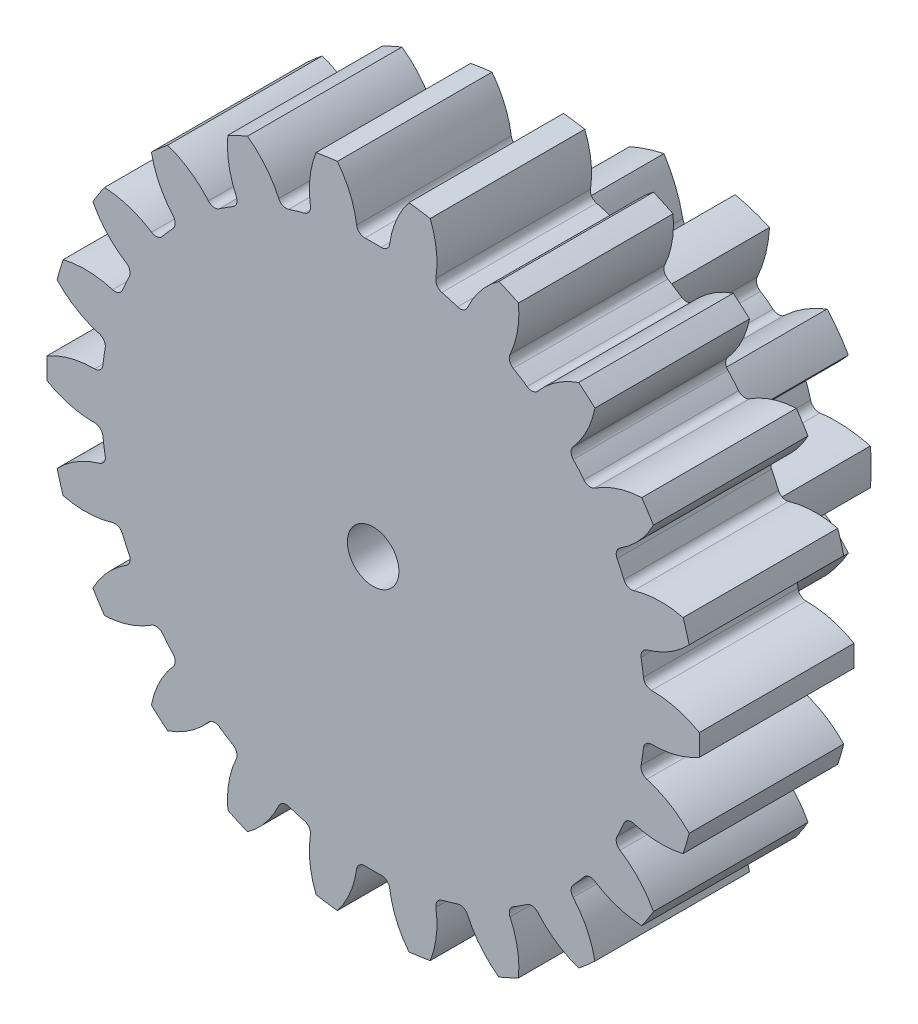
from build123d import *

# Parameters (mm, degrees)
SKETCH1_R                = 10
BOSS_EXTRUDE1_DEPTH      = 5
CUT_EXTRUDE1_DEPTH       = 16
FILLET2_R                = 0.5
CIRPATTERN1_COUNT        = 10
FILLET2_OF_CIRPATTERN1_R = 0.5
SKETCH4_R                = 19
BOSS_EXTRUDE2_DEPTH      = 9
CUT_EXTRUDE2_DEPTH       = 9
FILLET3_R                = 0.475
CIRPATTERN2_COUNT        = 22
FILLET3_OF_CIRPATTERN2_R = 0.475
SKETCH6_R                = 1.5
CUT_EXTRUDE3_DEPTH       = 33.843019557


with BuildPart() as part:
    # Sketch1 → Boss-Extrude1 (new, symmetric)
    with BuildSketch(Plane.XY):
        Circle(SKETCH1_R)
    extrude(amount=BOSS_EXTRUDE1_DEPTH, both=True)

    # Sketch3 → Cut-Extrude1 (cut, symmetric)
    with BuildSketch(Plane.XY):
        with BuildLine():
            ThreePointArc((-2.721939872, 10.657909895), (-1.519639498, 8.762901035), (-0.90177966, 6.605394605))
            ThreePointArc((-0.90177966, 6.605394605), (0, 6.666666667), (0.90177966, 6.605394605))
            ThreePointArc((0.90177966, 6.605394605), (1.519639498, 8.762901035), (2.721939872, 10.657909895))
            ThreePointArc((2.721939872, 10.657909895), (0, 11), (-2.721939872, 10.657909895))
        make_face()
    cut_extrude1 = extrude(amount=CUT_EXTRUDE1_DEPTH, both=True, mode=Mode.SUBTRACT)

    # Fillet2
    fillet2_edges = [part.edges().sort_by_distance(p)[0] for p in [
        (-0.90177966, 6.605394605, 0),
        (0.90177966, 6.605394605, 0),
    ]]
    fillet(fillet2_edges, radius=FILLET2_R)

    # CirPattern1: Cut-Extrude1 ×10 about axis
    cirpattern1_axis = Axis((0, 0, 0), (0, 0, 1))
    for i in range(1, CIRPATTERN1_COUNT):
        add(cut_extrude1.rotate(cirpattern1_axis, i * 360 / CIRPATTERN1_COUNT), mode=Mode.SUBTRACT)

    # Fillet2 of CirPattern1
    fillet2_of_cirpattern1_edges = [part.edges().sort_by_distance(p)[0] for p in [
        (-4.612108605, 4.813823705, 0),
        (-3.152998464, 5.873929275, 0),
        (-6.560768822, 1.183535765, 0),
        (-6.003438342, 2.89882261, 0),
        (-6.003438342, -2.89882261, 0),
        (-6.560768822, -1.183535765, 0),
        (-3.152998464, -5.873929275, 0),
        (-4.612108605, -4.813823705, 0),
        (0.90177966, -6.605394605, 0),
        (-0.90177966, -6.605394605, 0),
        (4.612108605, -4.813823705, 0),
        (3.152998464, -5.873929275, 0),
        (6.560768822, -1.183535765, 0),
        (6.003438342, -2.89882261, 0),
        (6.003438342, 2.89882261, 0),
        (6.560768822, 1.183535765, 0),
        (3.152998464, 5.873929275, 0),
        (4.612108605, 4.813823705, 0),
    ]]
    fillet(fillet2_of_cirpattern1_edges, radius=FILLET2_OF_CIRPATTERN1_R)


with BuildPart() as body_2:
    # Sketch4 → Boss-Extrude2 (new body)
    with BuildSketch(Plane.XY.offset(5)):
        Circle(SKETCH4_R)
    extrude(amount=BOSS_EXTRUDE2_DEPTH)

    # Sketch5 → Cut-Extrude2 (cut)
    with BuildSketch(Plane.XY.offset(14)):
        with BuildLine():
            ThreePointArc((-2.963435866, 19.779232742), (-1.520960757, 18.00924871), (-0.919276345, 15.806624417))
            ThreePointArc((-0.919276345, 15.806624417), (0, 15.833333333), (0.919276345, 15.806624417))
            ThreePointArc((0.919276345, 15.806624417), (1.520960757, 18.00924871), (2.963435866, 19.779232742))
            ThreePointArc((2.963435866, 19.779232742), (0, 20), (-2.963435866, 19.779232742))
        make_face()
    cut_extrude2 = extrude(amount=-CUT_EXTRUDE2_DEPTH, mode=Mode.SUBTRACT)

    # Fillet3
    fillet3_edges = [body_2.edges().sort_by_distance(p)[0] for p in [
        (-0.919276345, 15.806624417, 9.5),
        (0.919276345, 15.806624417, 9.5),
    ]]
    fillet(fillet3_edges, radius=FILLET3_R)

    # CirPattern2: Cut-Extrude2 ×22 about axis
    cirpattern2_axis = Axis((0, 0, 0), (0, 0, 1))
    for i in range(1, CIRPATTERN2_COUNT):
        add(cut_extrude2.rotate(cirpattern2_axis, i * 360 / CIRPATTERN2_COUNT), mode=Mode.SUBTRACT)

    # Fillet3 of CirPattern2
    fillet3_of_cirpattern2_edges = [body_2.edges().sort_by_distance(p)[0] for p in [
        (-5.335279906, 14.907354989, 9.5),
        (-3.571201518, 15.425335139, 9.5),
        (-9.319050819, 12.800380318, 9.5),
        (-7.772361873, 13.794376947, 9.5),
        (-12.547847657, 9.65639496, 9.5),
        (-11.343851693, 11.045880373, 9.5),
        (-14.760092503, 5.730105911, 9.5),
        (-13.996330113, 7.402512264, 9.5),
        (-15.776562436, 1.33959776, 9.5),
        (-15.514909107, 3.159436635, 9.5),
        (-15.514909107, -3.159436635, 9.5),
        (-15.776562436, -1.33959776, 9.5),
        (-13.996330113, -7.402512264, 9.5),
        (-14.760092503, -5.730105911, 9.5),
        (-11.343851693, -11.045880373, 9.5),
        (-12.547847657, -9.65639496, 9.5),
        (-7.772361873, -13.794376947, 9.5),
        (-9.319050819, -12.800380318, 9.5),
        (-3.571201518, -15.425335139, 9.5),
        (-5.335279906, -14.907354989, 9.5),
        (0.919276345, -15.806624417, 9.5),
        (-0.919276345, -15.806624417, 9.5),
        (5.335279906, -14.907354989, 9.5),
        (3.571201518, -15.425335139, 9.5),
        (9.319050819, -12.800380318, 9.5),
        (7.772361873, -13.794376947, 9.5),
        (12.547847657, -9.65639496, 9.5),
        (11.343851693, -11.045880373, 9.5),
        (14.760092503, -5.730105911, 9.5),
        (13.996330113, -7.402512264, 9.5),
        (15.776562436, -1.33959776, 9.5),
        (15.514909107, -3.159436635, 9.5),
        (15.514909107, 3.159436635, 9.5),
        (15.776562436, 1.33959776, 9.5),
        (13.996330113, 7.402512264, 9.5),
        (14.760092503, 5.730105911, 9.5),
        (11.343851693, 11.045880373, 9.5),
        (12.547847657, 9.65639496, 9.5),
        (7.772361873, 13.794376947, 9.5),
        (9.319050819, 12.800380318, 9.5),
        (3.571201518, 15.425335139, 9.5),
        (5.335279906, 14.907354989, 9.5),
    ]]
    fillet(fillet3_of_cirpattern2_edges, radius=FILLET3_OF_CIRPATTERN2_R)


with BuildPart() as cut_extrude3_tool:
    # Sketch6 → Cut-Extrude3 (new, through all)
    with BuildSketch(Plane.XY.offset(14)):
        Circle(SKETCH6_R)
    extrude(amount=-CUT_EXTRUDE3_DEPTH)


with BuildPart() as part_1:
    add(part.part)

    # Cut-Extrude3: cut by cut_extrude3_tool
    add(cut_extrude3_tool.part, mode=Mode.SUBTRACT)


with BuildPart() as body_2_1:
    add(body_2.part)

    # Cut-Extrude3: cut by cut_extrude3_tool
    add(cut_extrude3_tool.part, mode=Mode.SUBTRACT)


solid = Compound([part_1.part, body_2_1.part])
